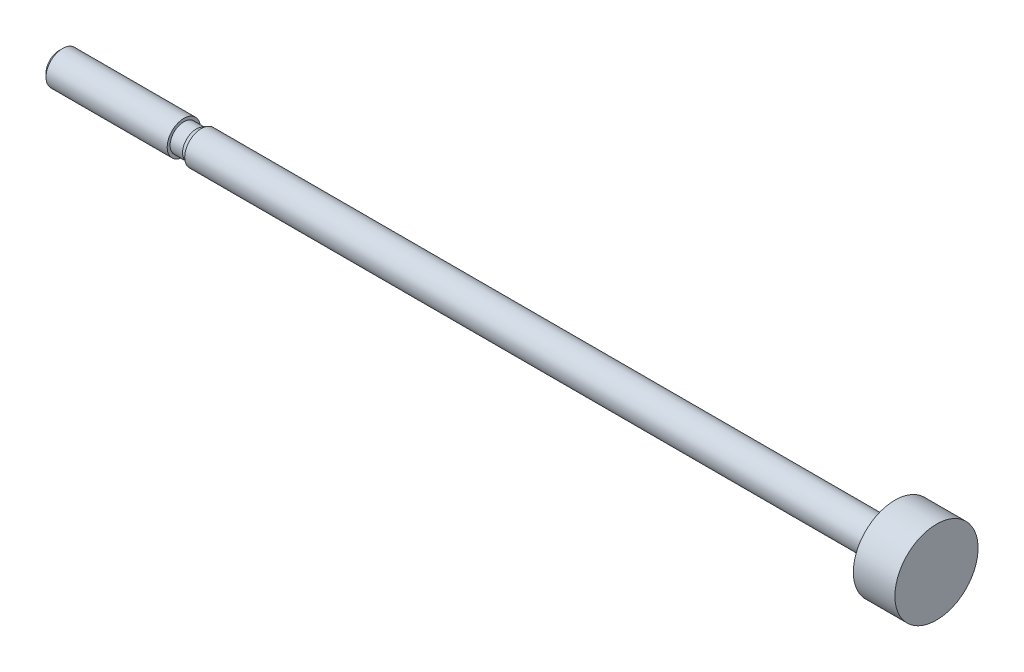
from build123d import *


with BuildPart() as part:
    # 草图1 → 旋转1 (revolve)
    with BuildSketch(Plane.XY, mode=Mode.PRIVATE) as revolve_1_sk:
        Polygon((0, 0), (0, 1.5705), (0.4295, 2), (15, 2), (15, 1.65), (16.5, 1.65), (17.106217783, 2), (100.5, 2), (100.5, 5), (105.5, 5), (105.5, 0), align=None)
    revolve(revolve_1_sk.sketch.rotate(Axis((105.5, 0, 0), (-1, 0, 0)), 270), axis=Axis((105.5, 0, 0), (-1, 0, 0)))


solid = part.part
